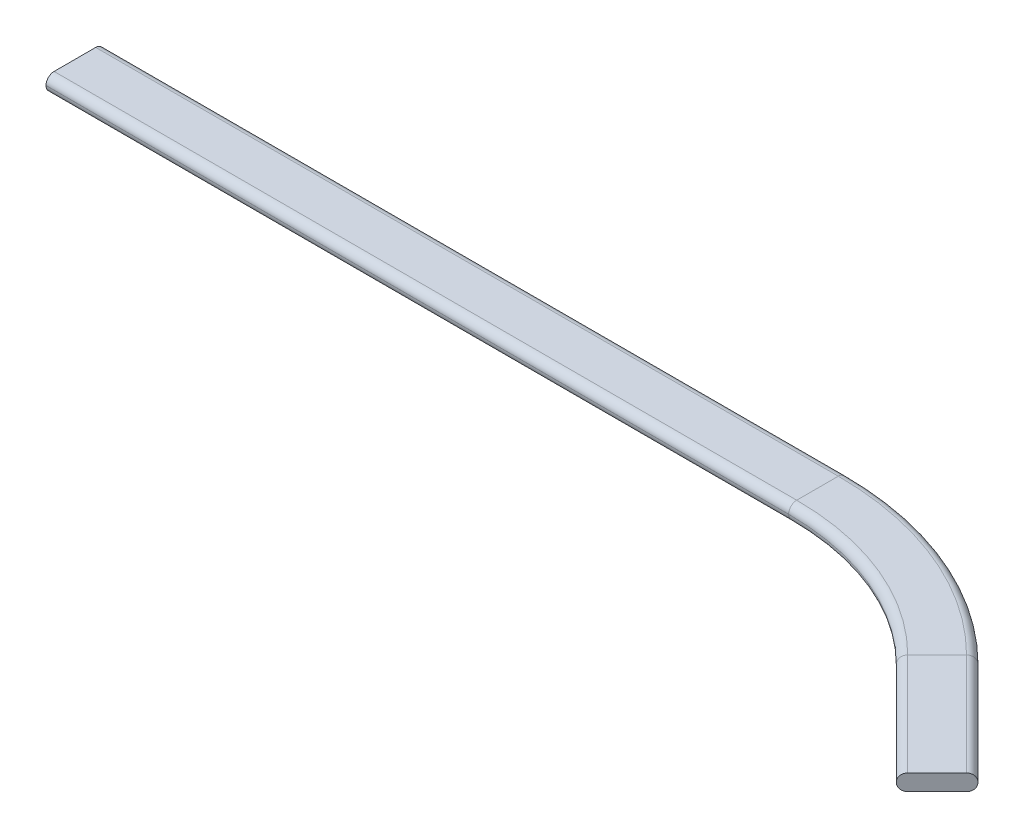
from build123d import *

# Parameters (mm, degrees)
SKETCH3_W           = 7
SKETCH3_H           = 1.97
FILLET1_R           = 0.98
SKETCH7_R           = 0.25
BOSS_EXTRUDE1_DEPTH = 0.6


with BuildPart() as part:
    # Sweep1: sweep along a path in Sketch1
    with BuildLine(Plane(origin=(0, 0, 0), x_dir=(1, 0, 0), z_dir=(0, 1, 0))) as sweep1_path:
        Line((0, 0), (90, 0))
        ThreePointArc((90, 0), (103.393920133, -2.664216362), (114.748737342, -10.251262658))
        Line((114.748737342, -10.251262658), (127.13092964, -22.633454957))
    # Sketch3 → Sweep1 (sweep)
    with BuildSketch(Plane(origin=(0, 0, 0), x_dir=(0, 0, -1), z_dir=(1, 0, 0))):
        Rectangle(SKETCH3_W, SKETCH3_H)
    sweep(path=sweep1_path.line)

    # Fillet1
    fillet1_edges = [part.edges().sort_by_distance(p)[0] for p in [
        (45, -0.985, -3.5),
        (45, 0.985, -3.5),
        (45, 0.985, 3.5),
        (45, -0.985, 3.5),
        (104.733312146, -0.985, -0.569362002),
        (104.733312146, 0.985, -0.569362002),
        (102.05452812, 0.985, 5.897794726),
        (102.05452812, -0.985, 5.897794726),
        (123.414707225, -0.985, 13.967485074),
        (123.414707225, 0.985, 13.967485074),
        (118.464959757, 0.985, 18.917232542),
        (118.464959757, -0.985, 18.917232542),
    ]]
    fillet(fillet1_edges, radius=FILLET1_R)


with BuildPart() as body_2:
    # Sketch7 → Boss-Extrude1 (new body)
    with BuildSketch(Plane.XY.offset(0.3)):
        with BuildLine():
            Line((1.487306111, -0.995), (0, -0.995))
            ThreePointArc((0, -0.995), (-0.473935601, -1.654326852), (0.30204267, -1.893459817))
            Line((0.30204267, -1.893459817), (1.487306111, -0.995))
        make_face()
        with Locations(Location((0, -1.495, 0), (0, 0, 180))):
            Circle(SKETCH7_R, mode=Mode.SUBTRACT)
    extrude(amount=-BOSS_EXTRUDE1_DEPTH)


solid = Compound([part.part, body_2.part])
